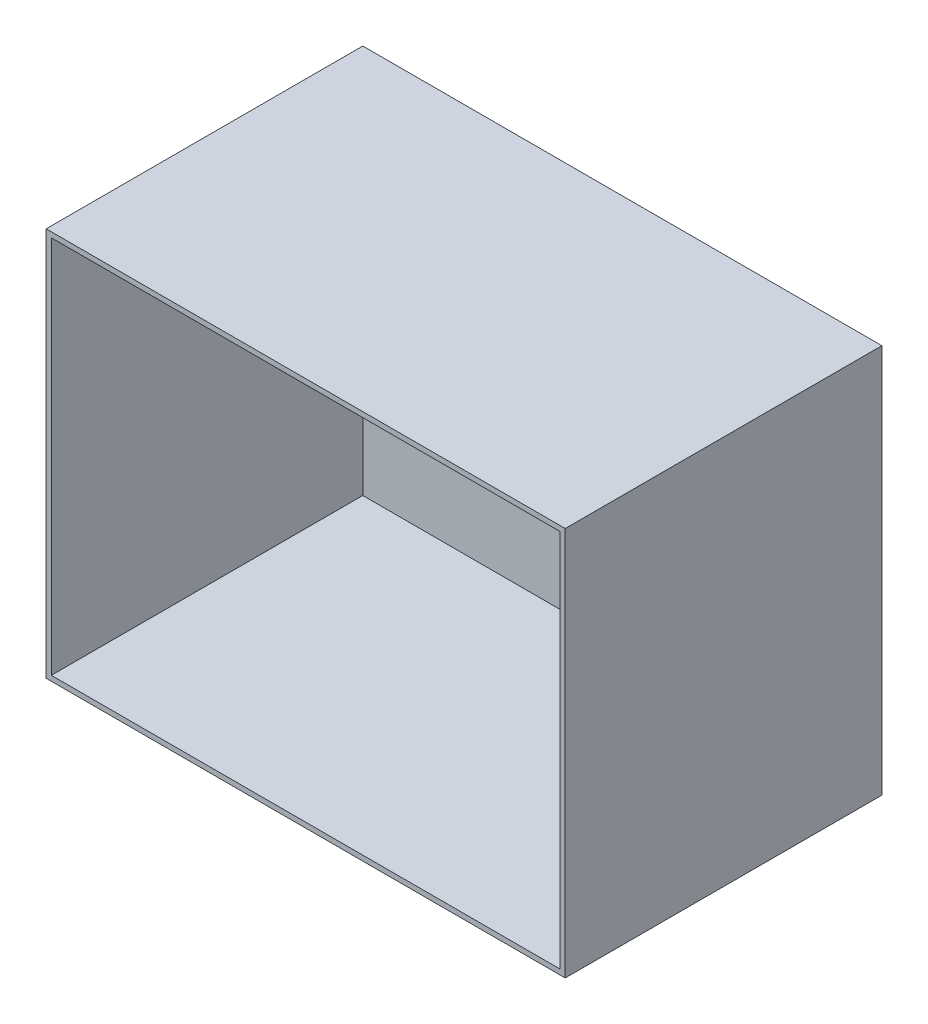
from build123d import *

# Parameters (mm, degrees)
SKETCH1_W           = 100
SKETCH1_H           = 75
BOSS_EXTRUDE1_DEPTH = 1
SKETCH2_W           = 1
SKETCH2_H           = 73
BOSS_EXTRUDE2_DEPTH = 60


with BuildPart() as part:
    # Sketch1 → Boss-Extrude1 (new body)
    with BuildSketch(Plane.XY):
        with Locations((50, 37.5)):
            Rectangle(SKETCH1_W, SKETCH1_H)
    extrude(amount=BOSS_EXTRUDE1_DEPTH)

    # Sketch2 → Boss-Extrude2 (add)
    with BuildSketch(Plane.XY.offset(1)):
        Polygon((100, 75), (0, 75), (0, 74), (1, 74), (99, 74), (100, 74), align=None)
        with Locations((0.5, 37.5)):
            Rectangle(SKETCH2_W, SKETCH2_H)
        Polygon((1, 1), (0, 1), (0, 0), (99, 0), (99, 1), align=None)
        Polygon((100, 0), (100, 74), (99, 74), (99, 1), (99, 0), align=None)
    extrude(amount=BOSS_EXTRUDE2_DEPTH)


solid = part.part
